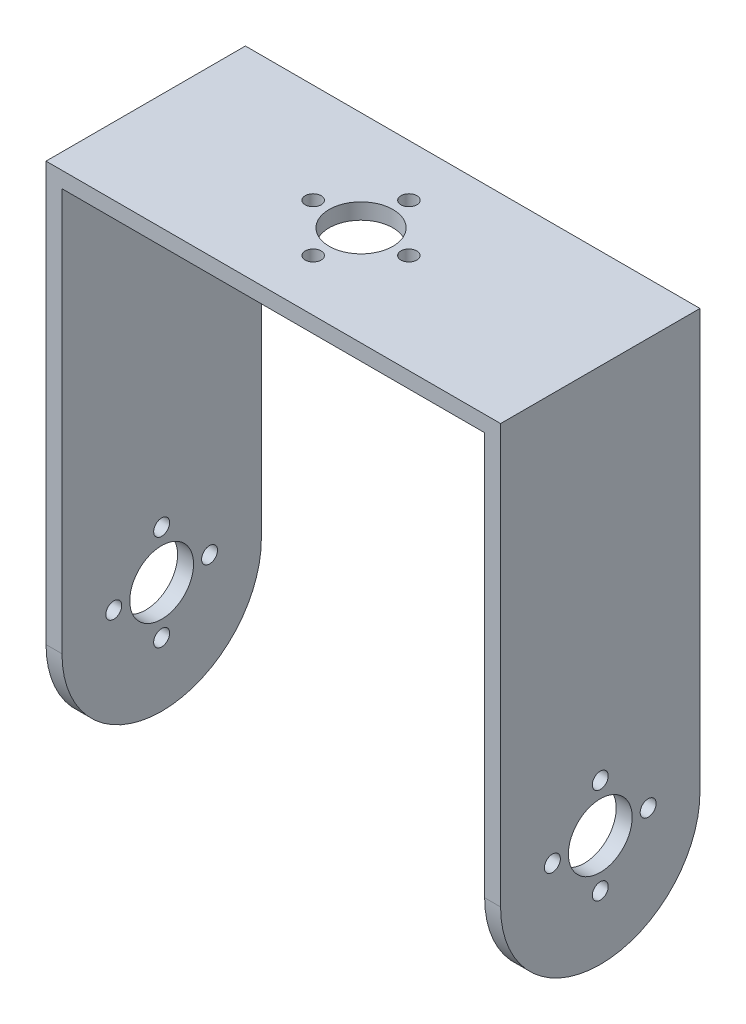
from build123d import *

# Parameters (mm, degrees)
BOSS_EXTRUDE2_DEPTH = 25
SKETCH4_R           = 4
CUT_EXTRUDE1_DEPTH  = 108.5257706
SKETCH6_R           = 4
CUT_EXTRUDE2_DEPTH  = 78.032036302
CUT_EXTRUDE3_DEPTH  = 78.032036302
SKETCH9_R           = 1
CUT_EXTRUDE4_DEPTH  = 78.032036302
SKETCH10_R          = 1
CUT_EXTRUDE5_DEPTH  = 108.5257706


with BuildPart() as part:
    # Sketch3 → Boss-Extrude2 (new body)
    with BuildSketch(Plane.XY):
        Polygon((-79.925523148, 45.386502584), (-27.042967192, 45.386502584), (-24.925523148, 45.386502584), (-24.925523148, -19.613497416), (-26.925523148, -19.613497416), (-26.925523148, 43.389953837), (-79.925523148, 43.389953837), (-79.925523148, -19.613497416), (-81.925523148, -19.613497416), (-81.925523148, 45.386502584), align=None)
    extrude(amount=BOSS_EXTRUDE2_DEPTH)

    # Sketch4 → Cut-Extrude1 (cut, through all)
    with BuildSketch(Plane(origin=(0, 45.386502584, 0), x_dir=(1, 0, 0), z_dir=(0, 1, 0))):
        with Locations(Location((-54.925523148, -12.5, 0), (0, 0, 270))):
            Circle(SKETCH4_R)
    extrude(amount=-CUT_EXTRUDE1_DEPTH, mode=Mode.SUBTRACT)

    # Sketch6 → Cut-Extrude2 (cut, through all)
    with BuildSketch(Plane.ZY.offset(81.925523148)):
        with Locations(Location((12.5, -5.613497416, 0), (0, 0, 270))):
            Circle(SKETCH6_R)
    extrude(amount=-CUT_EXTRUDE2_DEPTH, mode=Mode.SUBTRACT)

    # Sketch8 → Cut-Extrude3 (cut, through all)
    with BuildSketch(Plane.ZY.offset(81.925523148)):
        with BuildLine():
            Line((0, -19.613497416), (12.5, -19.613497416))
            ThreePointArc((12.5, -19.613497416), (3.661165213, -15.952332159), (0, -7.113497352))
            Line((0, -7.113497352), (0, -19.613497416))
        make_face()
        with BuildLine():
            Line((12.5, -19.613497416), (25, -19.613497416))
            Line((25, -19.613497416), (25, -7.113497416))
            ThreePointArc((25, -7.113497416), (21.338834765, -15.952332181), (12.5, -19.613497416))
        make_face()
    extrude(amount=-CUT_EXTRUDE3_DEPTH, mode=Mode.SUBTRACT)

    # Sketch9 → Cut-Extrude4 (cut, through all)
    with BuildSketch(Plane(origin=(-24.925523148, 0, 0), x_dir=(0, 0, -1), z_dir=(1, 0, 0))):
        with Locations(Location((-12.5, -11.6185898, 0), (0, 0, 90))):
            Circle(SKETCH9_R)
        with Locations(Location((-18.505092383, -5.613497416, 0), (0, 0, 90))):
            Circle(SKETCH9_R)
        with Locations(Location((-6.494907617, -5.613497416, 0), (0, 0, 90))):
            Circle(SKETCH9_R)
        with Locations(Location((-12.5, 0.391594967, 0), (0, 0, 90))):
            Circle(SKETCH9_R)
    extrude(amount=-CUT_EXTRUDE4_DEPTH, mode=Mode.SUBTRACT)

    # Sketch10 → Cut-Extrude5 (cut, through all)
    with BuildSketch(Plane(origin=(0, 45.386502584, 0), x_dir=(1, 0, 0), z_dir=(0, 1, 0))):
        with Locations(Location((-48.925524223, -12.499998866, 0), (0, 0, 270))):
            Circle(SKETCH10_R)
        with Locations(Location((-54.925524223, -6.499998866, 0), (0, 0, 270))):
            Circle(SKETCH10_R)
        with Locations(Location((-54.925524223, -18.499998866, 0), (0, 0, 270))):
            Circle(SKETCH10_R)
        with Locations(Location((-60.925524223, -12.499998866, 0), (0, 0, 270))):
            Circle(SKETCH10_R)
    extrude(amount=-CUT_EXTRUDE5_DEPTH, mode=Mode.SUBTRACT)


solid = part.part
